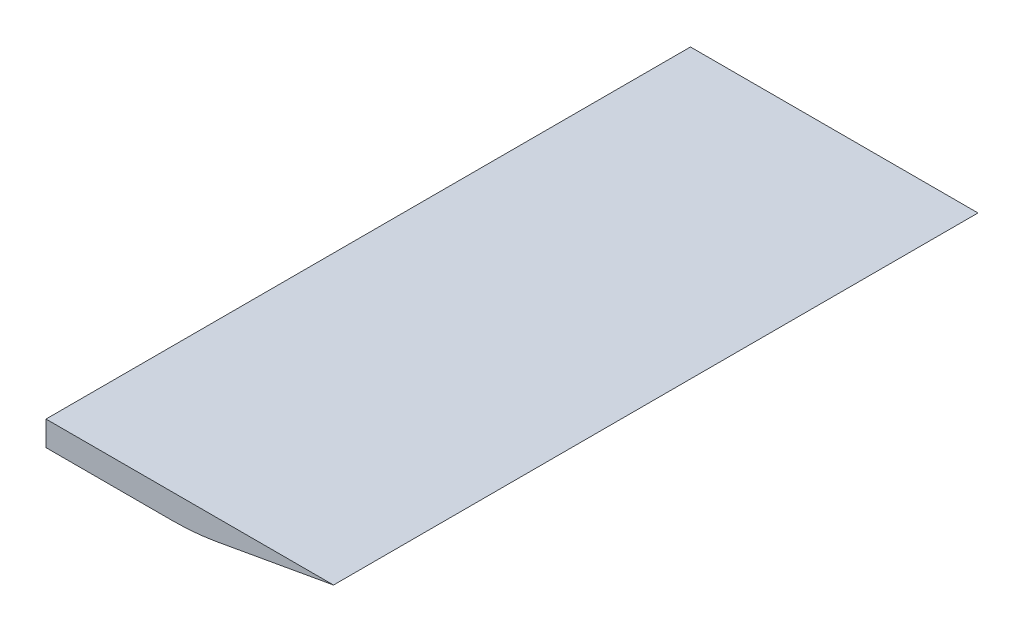
from build123d import *

# Parameters (mm, degrees)
BOSS_EXTRUDE1_DEPTH = 130
FILLET1_R           = 50


with BuildPart() as part:
    # Sketch1 → Boss-Extrude1 (new body)
    with BuildSketch(Plane.XY):
        Polygon((0, 0), (58, 0), (30, -5), (0, -5), align=None)
    extrude(amount=BOSS_EXTRUDE1_DEPTH)

    # Fillet1
    fillet1_edges = [part.edges().sort_by_distance(p)[0] for p in [
        (30, -5, 65),
    ]]
    fillet(fillet1_edges, radius=FILLET1_R)


solid = part.part
